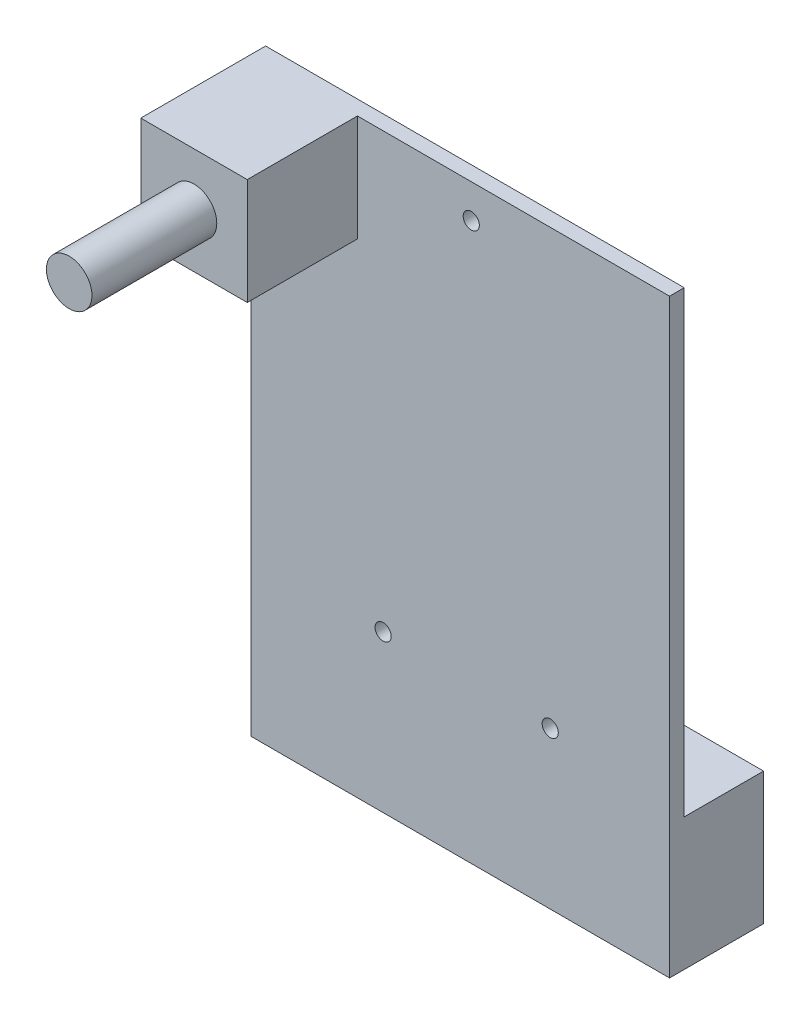
from build123d import *

# Parameters (mm, degrees)
SKETCH1_W               = 80.4
SKETCH1_H               = 57
BOSS_EXTRUDE1_DEPTH     = 17
SKETCH2_R               = 3.1
BOSS_EXTRUDE2_DEPTH     = 17
SKETCH3_W               = 57
SKETCH3_H               = 18
BOSS_EXTRUDE3_DEPTH     = 10.8
CUT_EXTRUDE1_DEPTH      = 15
CUT_EXTRUDE2_DEPTH      = 60.868940194
CUT_EXTRUDE2_DEPTH_BACK = 60.868940194
SKETCH5_R               = 1.1


with BuildPart() as part:
    # Sketch1 → Boss-Extrude1 (new body)
    with BuildSketch(Plane(origin=(0, 0, 0), x_dir=(0, 1, 0), z_dir=(0, 0, 1))):
        Rectangle(SKETCH1_W, SKETCH1_H)
    extrude(amount=BOSS_EXTRUDE1_DEPTH)

    # Sketch2 → Boss-Extrude2 (add)
    with BuildSketch(Plane.XY.offset(17)):
        with Locations((-21.25, 32.95)):
            Circle(SKETCH2_R)
    extrude(amount=BOSS_EXTRUDE2_DEPTH)

    # Sketch3 → Boss-Extrude3 (add)
    with BuildSketch(Plane(origin=(0, 0, 0), x_dir=(1, 0, 0), z_dir=(0, 0, -1))):
        with Locations((0, 31.2)):
            Rectangle(SKETCH3_W, SKETCH3_H)
    extrude(amount=BOSS_EXTRUDE3_DEPTH)

    # Sketch4 → Cut-Extrude1 (cut)
    with BuildSketch(Plane.XY.offset(17)):
        Polygon((-14, 40.2), (-14, 25.7), (-28.5, 25.7), (-28.5, -40.2), (28.5, -40.2), (28.5, 40.2), align=None)
    extrude(amount=-CUT_EXTRUDE1_DEPTH, mode=Mode.SUBTRACT)

    # Sketch5 → Cut-Extrude2 (cut, two sides: drawn at the far end of the back side and taken through both)
    with BuildSketch(Plane(origin=(0, 0, 0), x_dir=(1, 0, 0), z_dir=(0, 0, -1)).offset(-CUT_EXTRUDE2_DEPTH_BACK)):
        with Locations((1.5, -35.6)):
            Circle(SKETCH5_R)
        with Locations((-10.5, 18.877250546)):
            Circle(SKETCH5_R)
        with Locations((12.249999272, 18.87149398)):
            Circle(SKETCH5_R)
    extrude(amount=CUT_EXTRUDE2_DEPTH + CUT_EXTRUDE2_DEPTH_BACK, mode=Mode.SUBTRACT)


solid = part.part
